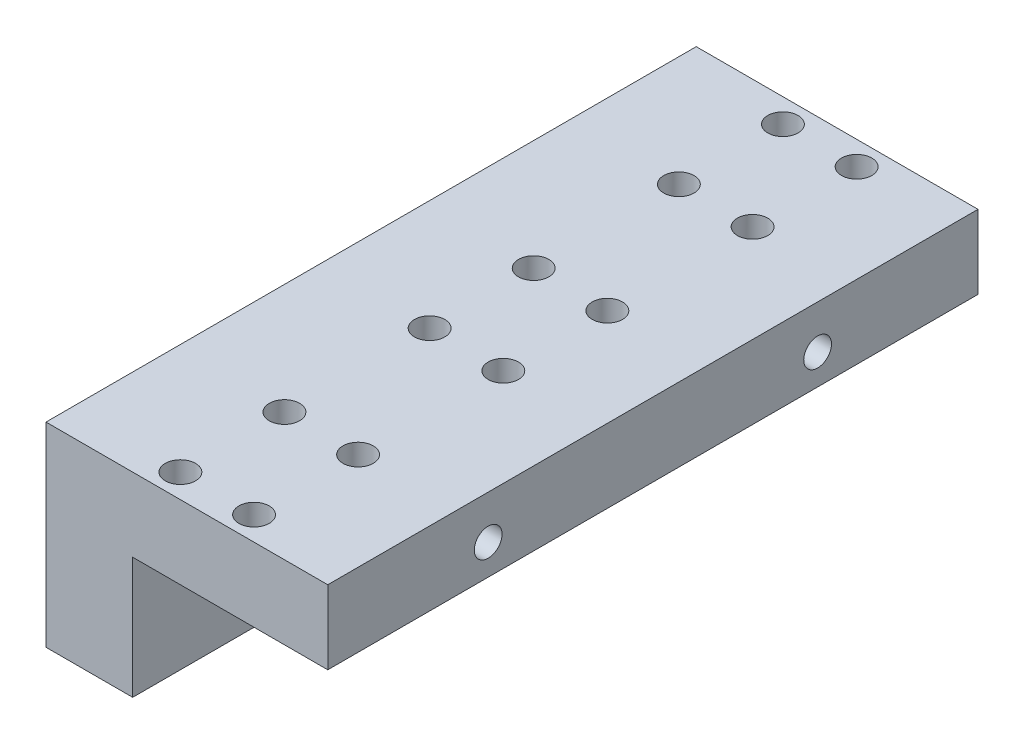
from build123d import *

# Parameters (mm, degrees)
BOSS_EXTRUDE1_DEPTH = 150
SKETCH3_R           = 4.25
SKETCH3_R_2         = 3.2
CUT_EXTRUDE1_DEPTH  = 170.558249578
SKETCH4_R           = 2
CUT_EXTRUDE2_DEPTH  = 166.858373319
SKETCH5_R           = 3.5
CUT_EXTRUDE3_DEPTH  = 5


with BuildPart() as part:
    # Sketch2 → Boss-Extrude1 (new body)
    with BuildSketch(Plane.XY):
        Polygon((0, 0), (0, 45), (65, 45), (65, 28), (20, 28), (20, 0), align=None)
    extrude(amount=BOSS_EXTRUDE1_DEPTH)

    # Sketch3 → Cut-Extrude1 (cut, through all)
    with BuildSketch(Plane.ZY):
        with Locations((17.5, 19)):
            Circle(SKETCH3_R)
        with Locations((132.5, 19)):
            Circle(SKETCH3_R)
        with Locations((75, 13)):
            Circle(SKETCH3_R)
        with Locations((37, 35)):
            Circle(SKETCH3_R_2)
        with Locations((113, 35)):
            Circle(SKETCH3_R_2)
    extrude(amount=-CUT_EXTRUDE1_DEPTH, mode=Mode.SUBTRACT)

    # Sketch4 → Cut-Extrude2 (cut, through all)
    with BuildSketch(Plane(origin=(0, 28, 0), x_dir=(1, 0, 0), z_dir=(0, 1, 0))):
        with Locations(Location((42.5, -29.5, 0), (0, 0, 180))):
            Circle(SKETCH4_R)
        with Locations(Location((42.5, -5.5, 0), (0, 0, 180))):
            Circle(SKETCH4_R)
        with Locations(Location((25.5, -5.5, 0), (0, 0, 180))):
            Circle(SKETCH4_R)
        with Locations(Location((25.5, -29.5, 0), (0, 0, 180))):
            Circle(SKETCH4_R)
        with Locations((42.5, -144.5)):
            Circle(SKETCH4_R)
        with Locations((42.5, -120.5)):
            Circle(SKETCH4_R)
        with Locations((25.5, -120.5)):
            Circle(SKETCH4_R)
        with Locations((25.5, -144.5)):
            Circle(SKETCH4_R)
        with Locations(Location((42.5, -87, 0), (0, 0, 180))):
            Circle(SKETCH4_R)
        with Locations(Location((42.5, -63, 0), (0, 0, 180))):
            Circle(SKETCH4_R)
        with Locations(Location((25.5, -63, 0), (0, 0, 180))):
            Circle(SKETCH4_R)
        with Locations(Location((25.5, -87, 0), (0, 0, 180))):
            Circle(SKETCH4_R)
    extrude(amount=CUT_EXTRUDE2_DEPTH, mode=Mode.SUBTRACT)

    # Sketch5 → Cut-Extrude3 (cut)
    with BuildSketch(Plane(origin=(0, 45, 0), x_dir=(1, 0, 0), z_dir=(0, 1, 0))):
        with Locations(Location((25.5, -5.5, 0), (0, 0, 270))):
            Circle(SKETCH5_R)
        with Locations(Location((42.5, -5.5, 0), (0, 0, 270))):
            Circle(SKETCH5_R)
        with Locations(Location((25.5, -29.5, 0), (0, 0, 270))):
            Circle(SKETCH5_R)
        with Locations(Location((42.5, -29.5, 0), (0, 0, 270))):
            Circle(SKETCH5_R)
        with Locations(Location((25.5, -63, 0), (0, 0, 270))):
            Circle(SKETCH5_R)
        with Locations(Location((42.5, -63, 0), (0, 0, 270))):
            Circle(SKETCH5_R)
        with Locations(Location((25.5, -87, 0), (0, 0, 270))):
            Circle(SKETCH5_R)
        with Locations(Location((42.5, -87, 0), (0, 0, 270))):
            Circle(SKETCH5_R)
        with Locations(Location((25.5, -120.5, 0), (0, 0, 270))):
            Circle(SKETCH5_R)
        with Locations(Location((42.5, -120.5, 0), (0, 0, 270))):
            Circle(SKETCH5_R)
        with Locations(Location((42.5, -144.5, 0), (0, 0, 270))):
            Circle(SKETCH5_R)
        with Locations(Location((25.5, -144.5, 0), (0, 0, 270))):
            Circle(SKETCH5_R)
    extrude(amount=-CUT_EXTRUDE3_DEPTH, mode=Mode.SUBTRACT)


solid = part.part
